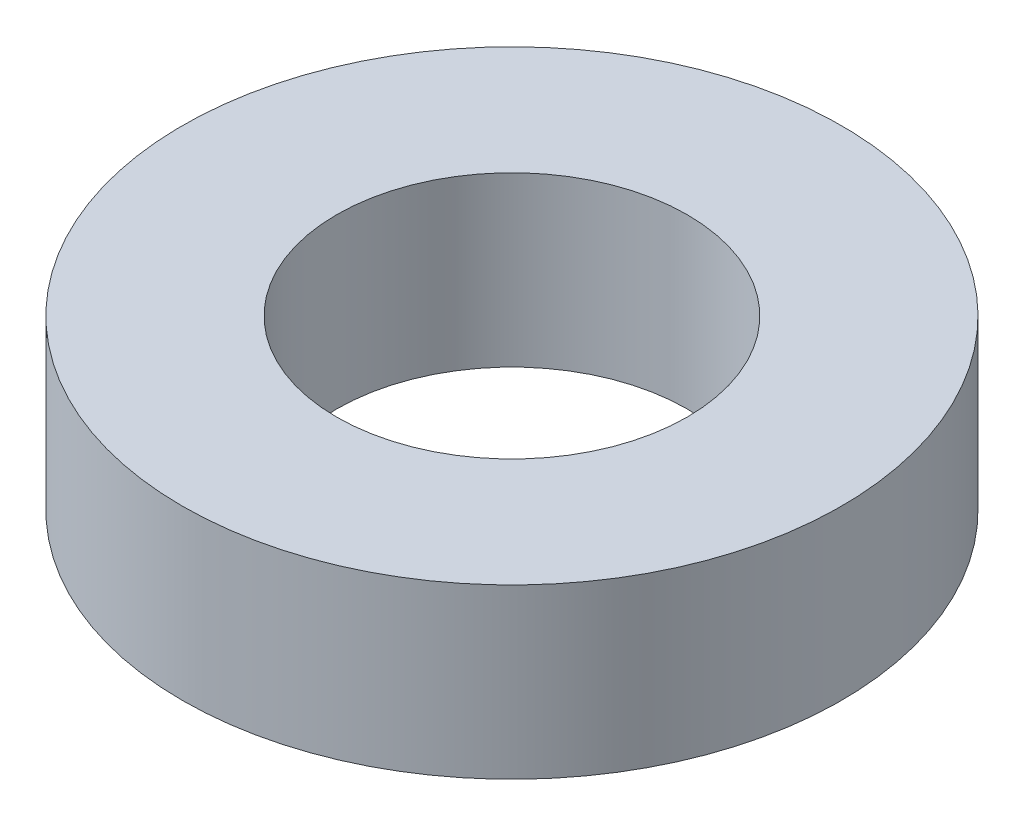
from build123d import *

# Parameters (mm, degrees)
SKETCH_1_R      = 23.5
SKETCH_1_R_2    = 12.5
EXTRUDE_2_DEPTH = 12


with BuildPart() as part:
    # 草图1 → 凸台-拉伸2 (new body)
    with BuildSketch(Plane(origin=(0, 0, 0), x_dir=(1, 0, 0), z_dir=(0, 1, 0))):
        with Locations(Location((0, 0, 0), (0, 0, 270))):
            Circle(SKETCH_1_R)
        with Locations(Location((0, 0, 0), (0, 0, 270))):
            Circle(SKETCH_1_R_2, mode=Mode.SUBTRACT)
    extrude(amount=EXTRUDE_2_DEPTH)


solid = part.part
